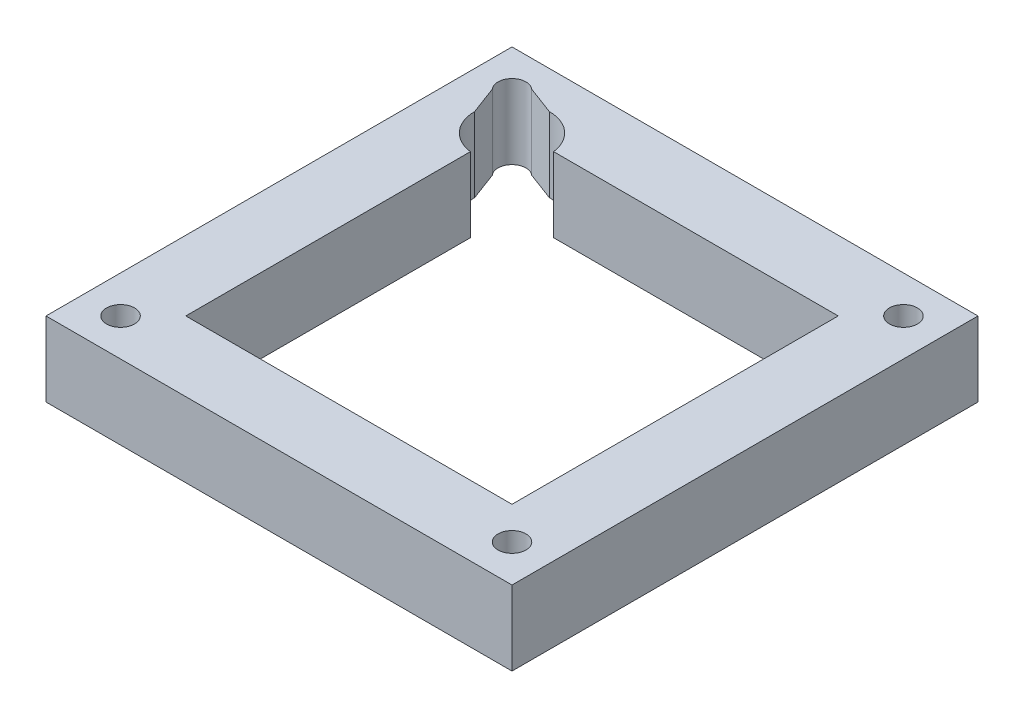
from build123d import *

# Parameters (mm, degrees)
SKETCH1_W     = 50
SKETCH1_H     = 50
SKETCH1_R     = 1.5
SUPPORT_DEPTH = 8


with BuildPart() as part:
    # Sketch1 → Support (new body)
    with BuildSketch(Plane(origin=(0, 0, 0), x_dir=(1, 0, 0), z_dir=(0, 1, 0))):
        Rectangle(SKETCH1_W, SKETCH1_H)
        with Locations(Location((-21, -21, 0), (0, 0, 270))):
            Circle(SKETCH1_R, mode=Mode.SUBTRACT)
        with Locations(Location((21, -21, 0), (0, 0, 270))):
            Circle(SKETCH1_R, mode=Mode.SUBTRACT)
        with BuildLine():
            Line((-13.031373033, 17.5), (17.5, 17.5))
            Line((17.5, 17.5), (17.5, -17.5))
            Line((17.5, -17.5), (-17.5, -17.5))
            Line((-17.5, -17.5), (-17.5, 13.031373033))
            ThreePointArc((-17.5, 13.031373033), (-20, 14.354248689), (-21, 17))
            Line((-21, 17), (-22.130136986, 20.01369863))
            ThreePointArc((-22.130136986, 20.01369863), (-22.060660172, 22.060660172), (-20.01369863, 22.130136986))
            Line((-20.01369863, 22.130136986), (-17, 21))
            ThreePointArc((-17, 21), (-14.354248689, 20), (-13.031373033, 17.5))
        make_face(mode=Mode.SUBTRACT)
        with Locations(Location((21, 21, 0), (0, 0, 270))):
            Circle(SKETCH1_R, mode=Mode.SUBTRACT)
    extrude(amount=SUPPORT_DEPTH)


solid = part.part
